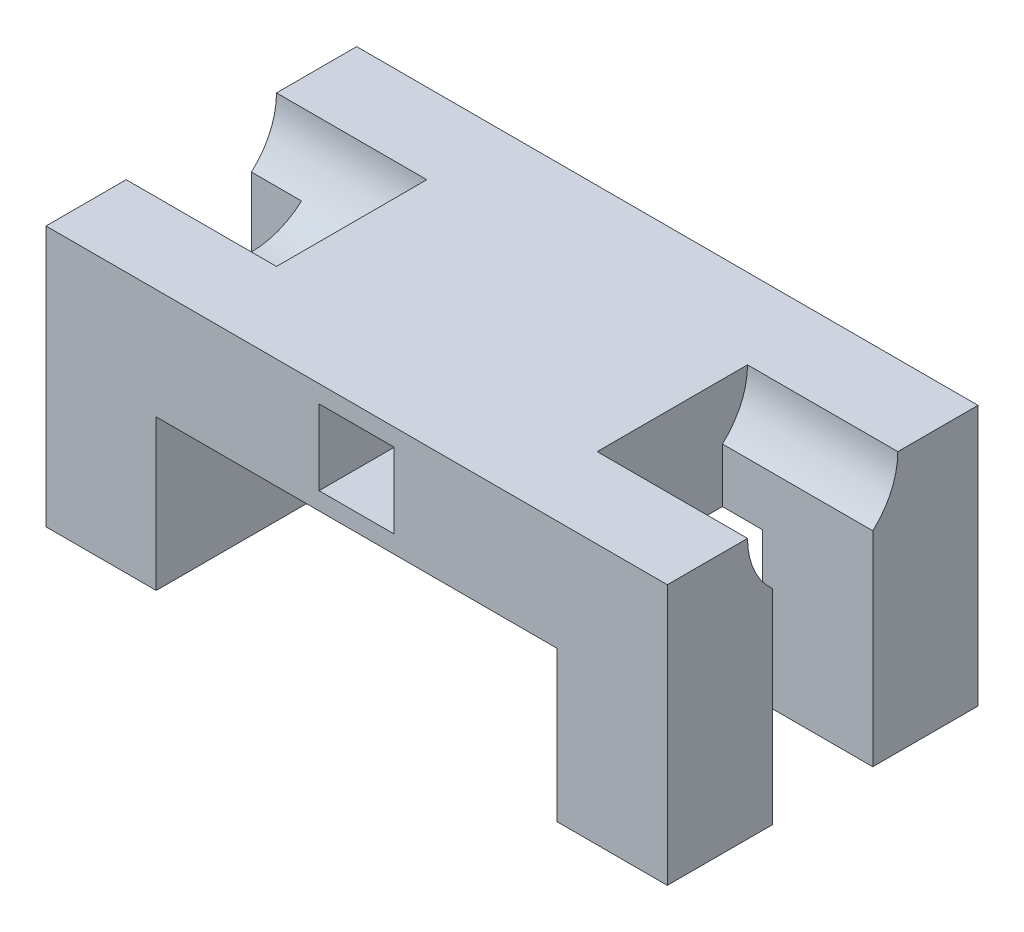
from build123d import *

# Parameters (mm, degrees)
SKETCH1_W           = 15
SKETCH1_H           = 15
BOSS_EXTRUDE2_DEPTH = 62
SKETCH2_W           = 20
SKETCH2_H           = 52
CUT_EXTRUDE1_DEPTH  = 10
CUT_EXTRUDE2_DEPTH  = 30
SKETCH5_W           = 20
SKETCH5_H           = 52
CUT_EXTRUDE4_DEPTH  = 30
CUT_EXTRUDE5_START  = -30
CUT_EXTRUDE5_DEPTH  = 30


with BuildPart() as part:
    # Sketch1 → Boss-Extrude2 (new body)
    with BuildSketch(Plane.XY):
        Polygon((0, 0), (0, 52), (124, 52), (124, 0.029795627), (102, 0.029795627), (102, 30), (22, 30), (22, 0), align=None)
        with Locations((62, 41)):
            Rectangle(SKETCH1_W, SKETCH1_H, mode=Mode.SUBTRACT)
    extrude(amount=BOSS_EXTRUDE2_DEPTH)

    # Sketch2 → Cut-Extrude1 (cut)
    with BuildSketch(Plane.ZY):
        with Locations((31, 26)):
            Rectangle(SKETCH2_W, SKETCH2_H)
    extrude(amount=-CUT_EXTRUDE1_DEPTH, mode=Mode.SUBTRACT)

    # Sketch3 → Cut-Extrude2 (cut)
    with BuildSketch(Plane.ZY):
        with BuildLine():
            Line((16, 52), (46, 52))
            ThreePointArc((46, 52), (31, 37), (16, 52))
        make_face()
    extrude(amount=-CUT_EXTRUDE2_DEPTH, mode=Mode.SUBTRACT)

    # Sketch5 → Cut-Extrude4 (cut)
    with BuildSketch(Plane(origin=(124, 0, 0), x_dir=(0, 0, -1), z_dir=(1, 0, 0))):
        with Locations((-31, 26)):
            Rectangle(SKETCH5_W, SKETCH5_H)
    extrude(amount=-CUT_EXTRUDE4_DEPTH, mode=Mode.SUBTRACT)

    # Sketch6 → Cut-Extrude5 (cut)
    with BuildSketch(Plane(origin=(124, 0, 0), x_dir=(0, 0, -1), z_dir=(1, 0, 0)).offset(CUT_EXTRUDE5_START)):
        with BuildLine():
            Line((-46, 52), (-16, 52))
            ThreePointArc((-16, 52), (-31, 37), (-46, 52))
        make_face()
    extrude(amount=CUT_EXTRUDE5_DEPTH, mode=Mode.SUBTRACT)


solid = part.part
